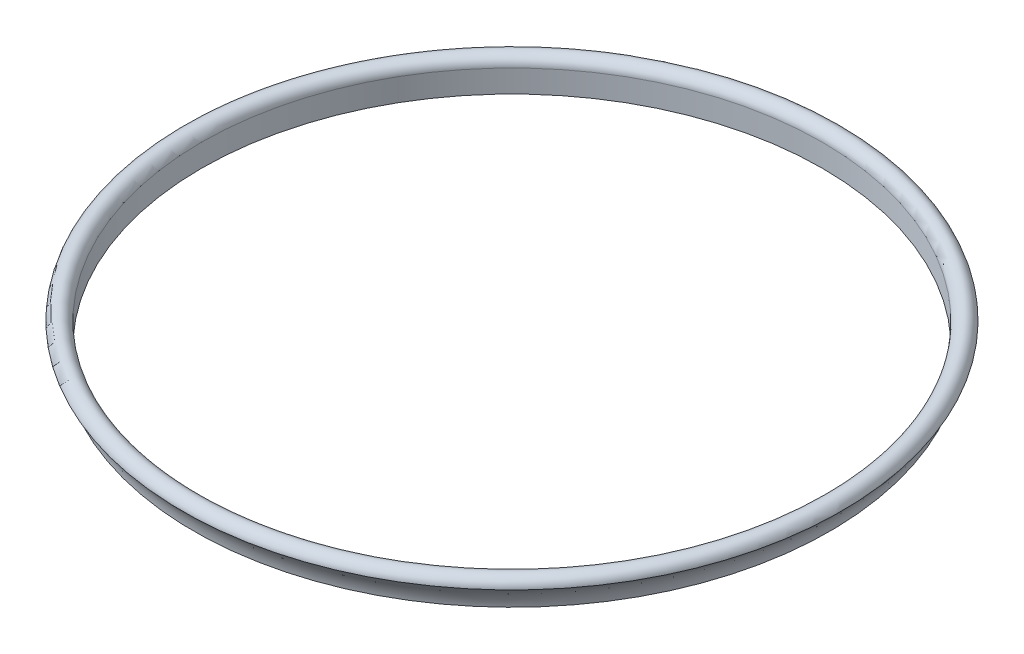
from build123d import *


with BuildPart() as part:
    # Sketch1 → Revolve1 (revolve)
    with BuildSketch(Plane.XY, mode=Mode.PRIVATE) as revolve1_sk:
        with BuildLine():
            Line((82.55, 0), (82.55, 6))
            ThreePointArc((82.55, 6), (85.020831476, 8.539058037), (87.626232847, 6.138285746))
            ThreePointArc((87.626232847, 6.138285746), (85.561991757, 3.338005188), (84.582, 0))
            Line((84.582, 0), (82.55, 0))
        make_face()
    revolve(revolve1_sk.sketch.rotate(Axis((0, 0, 0), (0, 1, 0)), 90), axis=Axis((0, 0, 0), (0, 1, 0)))


solid = part.part
